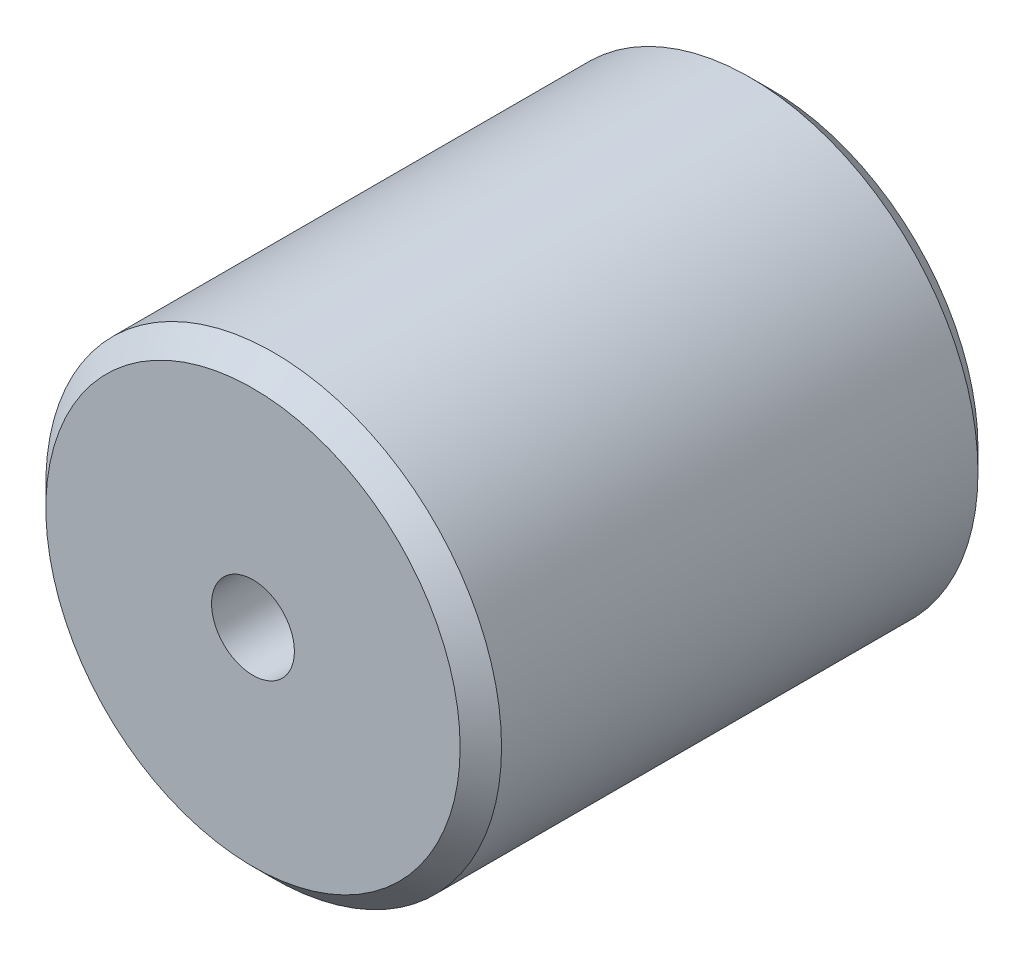
from build123d import *

# Parameters (mm, degrees)
SKIZZE1_R                       = 11
SKIZZE1_R_2                     = 2
AUFSATZ_LINEAR_AUSTRAGEN1_DEPTH = 25
FASE1_SIZE                      = 1


with BuildPart() as part:
    # Skizze1 → Aufsatz-Linear austragen1 (new body)
    with BuildSketch(Plane.XY):
        Circle(SKIZZE1_R)
        Circle(SKIZZE1_R_2, mode=Mode.SUBTRACT)
    extrude(amount=AUFSATZ_LINEAR_AUSTRAGEN1_DEPTH)

    # Fase1
    fase1_edges = [part.edges().sort_by_distance(p)[0] for p in [
        (-11, 0, 0),
        (-11, 0, 25),
    ]]
    chamfer(fase1_edges, length=FASE1_SIZE)


solid = part.part
